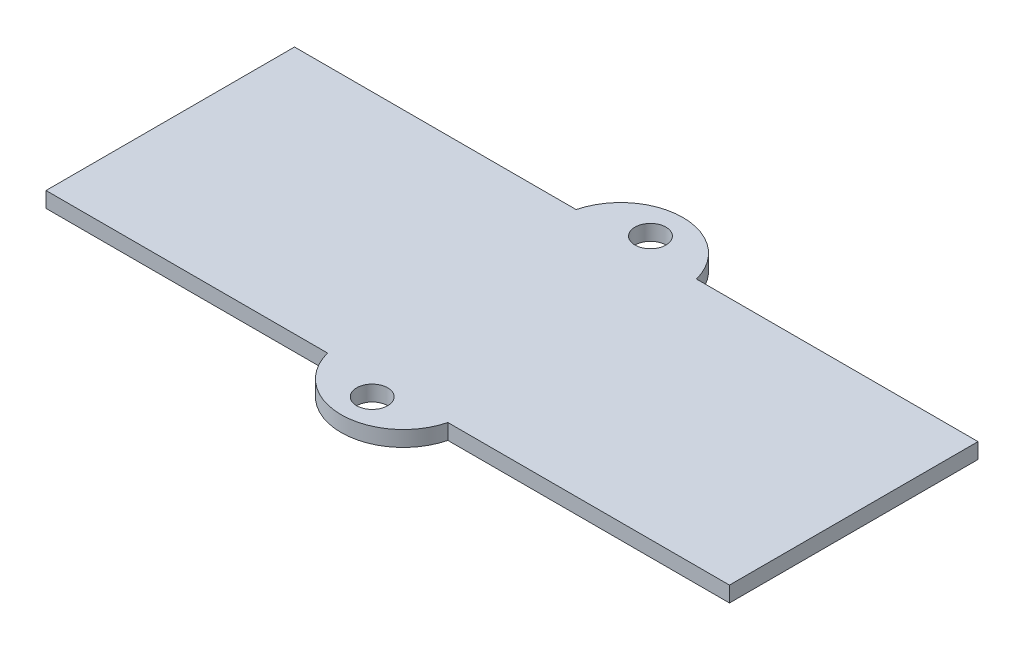
from build123d import *

# Parameters (mm, degrees)
SKETCH1_R           = 2
BOSS_EXTRUDE1_DEPTH = 2


with BuildPart() as part:
    # Sketch1 → Boss-Extrude1 (new body)
    with BuildSketch(Plane(origin=(0.878851429, -232.203669229, 17.838405177), x_dir=(1, 0, 0), z_dir=(0, 1, 0))):
        with BuildLine():
            Line((-76.605433247, -50.088644337), (-76.605433247, -18.088644337))
            Line((-76.605433247, -18.088644337), (-40.351399939, -18.088644337))
            ThreePointArc((-40.351399939, -18.088644337), (-32.605433247, -12.088644337), (-24.859466554, -18.088644337))
            Line((-24.859466554, -18.088644337), (11.394566753, -18.088644337))
            Line((11.394566753, -18.088644337), (11.394566753, -50.088644337))
            Line((11.394566753, -50.088644337), (-24.859466554, -50.088644337))
            ThreePointArc((-24.859466554, -50.088644337), (-32.605433247, -56.088644337), (-40.351399939, -50.088644337))
            Line((-40.351399939, -50.088644337), (-76.605433247, -50.088644337))
        make_face()
        with Locations(Location((-32.605433247, -52.088644337, 0), (0, 0, 270))):
            Circle(SKETCH1_R, mode=Mode.SUBTRACT)
        with Locations(Location((-32.605433247, -16.25918497, 0), (0, 0, 270))):
            Circle(SKETCH1_R, mode=Mode.SUBTRACT)
    extrude(amount=BOSS_EXTRUDE1_DEPTH)


solid = part.part
